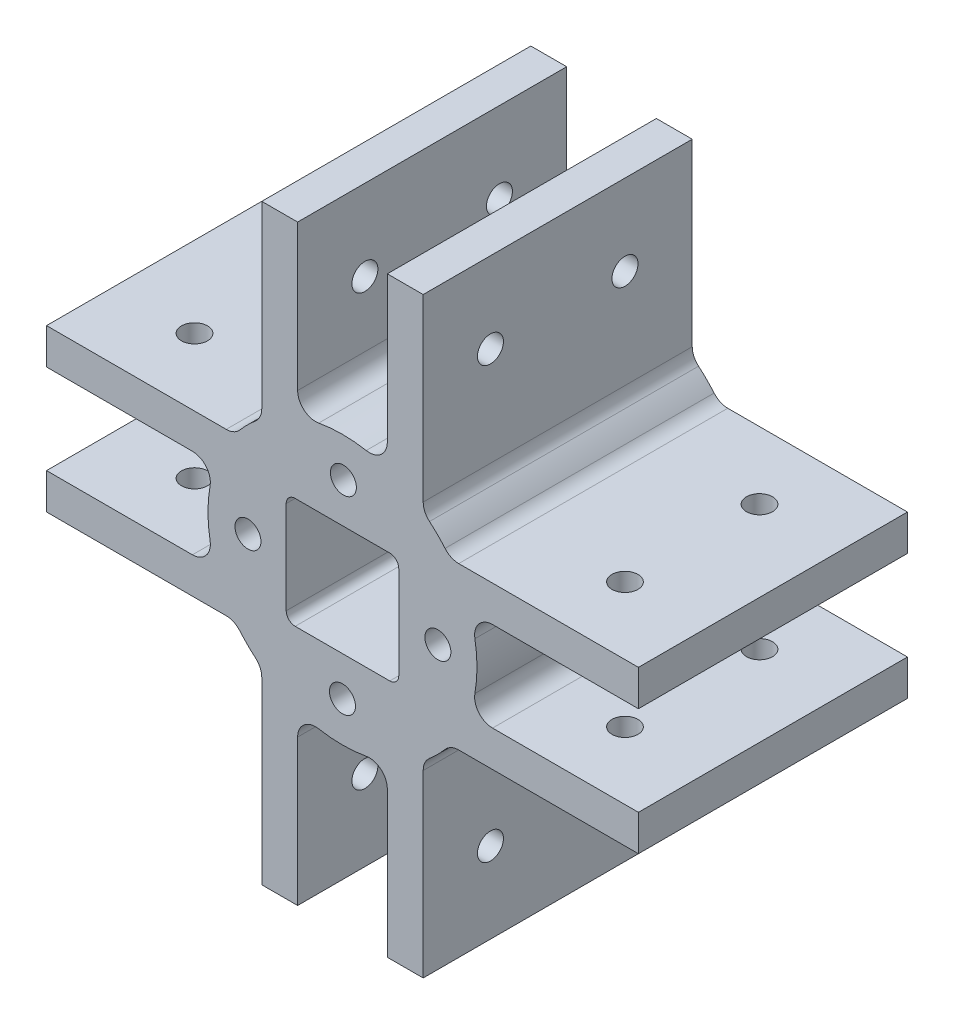
from build123d import *

# Parameters (mm, degrees)
SKETCH1_R                = 15
BOSS_EXTRUDE1_DEPTH      = 15
SKETCH4_W                = 4
SKETCH4_H                = 33
BOSS_EXTRUDE3_DEPTH      = 30
FILLET2_R                = 2
CIRPATTERN7_COUNT        = 4
FILLET2_OF_CIRPATTERN7_R = 2
SKETCH7_R                = 1.45
CUT_EXTRUDE2_DEPTH       = 27
CIRPATTERN9_COUNT        = 4
CUT_EXTRUDE3_REACH       = 57.48
SKETCH8_W                = 12.55
SKETCH8_H                = 12.35
SKETCH9_R                = 1.45
CUT_EXTRUDE4_DEPTH       = 10
FILLET1_R                = 1


with BuildPart() as part:
    # Sketch1 → Boss-Extrude1 (new, symmetric)
    with BuildSketch(Plane.XY):
        Circle(SKETCH1_R)
    extrude(amount=BOSS_EXTRUDE1_DEPTH, both=True)

    # Sketch4 → Boss-Extrude3 (add)
    with BuildSketch(Plane.XY.offset(15)):
        with Locations((-7, 16.5)):
            Rectangle(SKETCH4_W, SKETCH4_H)
        with Locations((7, 16.5)):
            Rectangle(SKETCH4_W, SKETCH4_H)
    boss_extrude3 = extrude(amount=-BOSS_EXTRUDE3_DEPTH)

    # Fillet2
    fillet2_edges = [part.edges().sort_by_distance(p)[0] for p in [
        (-9, 12, 0),
        (-5, 14.142135624, 0),
        (9, 12, 0),
        (5, 14.142135624, 0),
    ]]
    fillet(fillet2_edges, radius=FILLET2_R)

    # CirPattern7: Boss-Extrude3 ×4 about axis
    cirpattern7_axis = Axis((0, 0, 0), (0, 0, 1))
    for i in range(1, CIRPATTERN7_COUNT):
        add(boss_extrude3.rotate(cirpattern7_axis, i * 360 / CIRPATTERN7_COUNT))

    # Fillet2 of CirPattern7
    fillet2_of_cirpattern7_edges = [part.edges().sort_by_distance(p)[0] for p in [
        (-12, -9, 0),
        (-14.142135624, -5, 0),
        (-12, 9, 0),
        (-14.142135624, 5, 0),
        (9, -12, 0),
        (5, -14.142135624, 0),
        (-9, -12, 0),
        (-5, -14.142135624, 0),
        (12, 9, 0),
        (14.142135624, 5, 0),
        (12, -9, 0),
        (14.142135624, -5, 0),
    ]]
    fillet(fillet2_of_cirpattern7_edges, radius=FILLET2_OF_CIRPATTERN7_R)

    # Sketch7 → Cut-Extrude2 (cut)
    with BuildSketch(Plane.ZY.offset(9)):
        with Locations((-7.5, 24)):
            Circle(SKETCH7_R)
        with Locations((7.5, 24)):
            Circle(SKETCH7_R)
        with Locations((22.5, 24)):
            Circle(SKETCH7_R)
        with Locations((37.5, 24)):
            Circle(SKETCH7_R)
        with Locations((52.5, 24)):
            Circle(SKETCH7_R)
    cut_extrude2 = extrude(amount=-CUT_EXTRUDE2_DEPTH, mode=Mode.SUBTRACT)

    # CirPattern9: Cut-Extrude2 ×4 about axis
    cirpattern9_axis = Axis((0, 0, 0), (0, 0, 1))
    for i in range(1, CIRPATTERN9_COUNT):
        add(cut_extrude2.rotate(cirpattern9_axis, i * 360 / CIRPATTERN9_COUNT), mode=Mode.SUBTRACT)

    # Sketch8 → Cut-Extrude3 (cut, up to next)
    with BuildSketch(Plane.XY.offset(15), mode=Mode.PRIVATE) as cut_extrude3_sk1:
        Rectangle(SKETCH8_W, SKETCH8_H)
    cut_extrude3_tool1 = extrude(cut_extrude3_sk1.sketch, amount=-CUT_EXTRUDE3_REACH, mode=Mode.PRIVATE) & part.part
    add(cut_extrude3_tool1.solids().sort_by_distance((0, 0, 15))[0], mode=Mode.SUBTRACT)

    # Sketch9 → Cut-Extrude4 (cut)
    with BuildSketch(Plane.XY.offset(15)):
        with Locations((10.6375, 0)):
            Circle(SKETCH9_R)
        with Locations((0, -10.5375)):
            Circle(SKETCH9_R)
        with Locations((-10.5375, 0.1)):
            Circle(SKETCH9_R)
        with Locations((0.1, 10.6375)):
            Circle(SKETCH9_R)
    cut_extrude4 = extrude(amount=-CUT_EXTRUDE4_DEPTH, mode=Mode.SUBTRACT)

    # Fillet1
    fillet1_edges = [part.edges().sort_by_distance(p)[0] for p in [
        (6.275, 6.175, 0),
        (6.275, -6.175, 0),
        (-6.275, -6.175, 0),
        (-6.275, 6.175, 0),
    ]]
    fillet(fillet1_edges, radius=FILLET1_R)

    # Mirror1: Cut-Extrude4 across plane
    add(cut_extrude4.mirror(Plane.XY), mode=Mode.SUBTRACT)


solid = part.part
